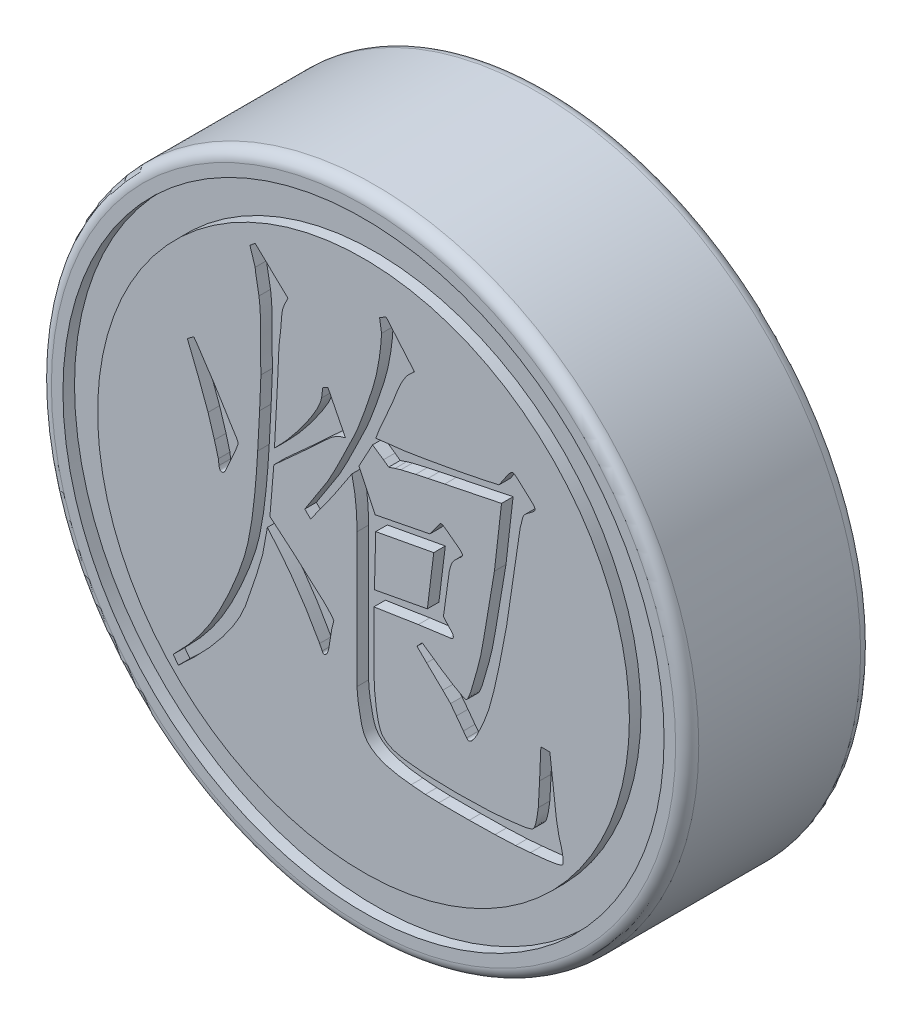
from build123d import *

# Parameters (mm, degrees)
SKETCH_1_R          = 14
EXTRUDE_1_DEPTH     = 8
SKETCH_2_R          = 13
SKETCH_2_R_2        = 11.5
CUT_EXTRUDE_1_DEPTH = 0.5
SKETCH_3_R          = 5.1
CUT_EXTRUDE_2_DEPTH = 5
CHAMFER_1_SIZE      = 0.5
FILLET_1_R          = 0.5
CUT_EXTRUDE_3_DEPTH = 0.5


with BuildPart() as part:
    # 草图1 → 凸台-拉伸1 (new body)
    with BuildSketch(Plane.XY):
        Circle(SKETCH_1_R)
    extrude(amount=EXTRUDE_1_DEPTH)

    # 草图2 → 切除-拉伸1 (cut)
    with BuildSketch(Plane.XY.offset(8)):
        Circle(SKETCH_2_R)
        Circle(SKETCH_2_R_2, mode=Mode.SUBTRACT)
    extrude(amount=-CUT_EXTRUDE_1_DEPTH, mode=Mode.SUBTRACT)

    # 草图3 → 切除-拉伸2 (cut)
    with BuildSketch(Plane(origin=(0, 0, 0), x_dir=(-1, 0, 0), z_dir=(0, 0, -1))):
        Circle(SKETCH_3_R)
    extrude(amount=-CUT_EXTRUDE_2_DEPTH, mode=Mode.SUBTRACT)

    # 倒角1
    chamfer_1_edges = [part.edges().sort_by_distance(p)[0] for p in [
        (5.1, 0, 0),
    ]]
    chamfer(chamfer_1_edges, length=CHAMFER_1_SIZE)

    # 圆角1
    fillet_1_edges = [part.edges().sort_by_distance(p)[0] for p in [
        (-14, 0, 0),
        (-14, 0, 8),
    ]]
    fillet(fillet_1_edges, radius=FILLET_1_R)

    # 草图4 → 切除-拉伸3 (cut)
    # profile 1 of 3: a face of its own
    with BuildSketch(Plane.XY.offset(8)):
        with BuildLine():
            add(Edge.make_bspline(
                [(-8.230784643, -7.445985051), (-8.038655709, -7.251958341), (-7.660131131, -6.869694842), (-7.149125234, -6.258608445), (-6.701948575, -5.62600949), (-6.317215514, -4.974370194), (-5.982119423, -4.312966272), (-5.676027104, -3.652166118), (-5.40756555, -2.989167779), (-5.207861307, -2.427128832), (-5.063947104, -1.949745176), (-4.97338362, -1.537920002), (-4.884536941, -1.076266151), (-4.803726509, -0.561800433), (-4.737674711, 0.005021424), (-4.672026968, 0.622494854), (-4.62141685, 1.292395047), (-4.592218628, 1.756200158), (-4.577045031, 1.997228245)],
                knots=[0, 0, 0, 0, 1.260269994, 2.482932462, 3.672818733, 4.833103206, 5.973250153, 7.094859764, 8.194451708, 9.274423702, 9.847723837, 10.495093642, 11.219979064, 12.018278646, 12.898683251, 13.854391619, 14.884980191, 16, 16, 16, 16], degree=3))
            Line((-4.577045031, 1.997228245), (-4.493942538, 3.548474783))
            add(Edge.make_bspline(
                [(-4.493942538, 3.548474783), (-4.489550303, 3.703607167), (-4.48154939, 3.986196903), (-4.467698162, 4.368473099), (-4.454911489, 4.668651158), (-4.443404657, 4.841194166), (-4.438540876, 4.914125752)],
                knots=[0, 0, 0, 0, 1.362474348, 2.481888401, 3.358314848, 4, 4, 4, 4], degree=3))
            add(Edge.make_bspline(
                [(-4.438540876, 4.914125752), (-4.438415042, 4.936287667), (-4.438116109, 4.988936203), (-4.441234191, 5.078531376), (-4.447582333, 5.19017632), (-4.452947112, 5.330537782), (-4.460081297, 5.51517482), (-4.456828192, 5.758086914), (-4.459725234, 6.066503803), (-4.450807023, 6.424706699), (-4.450253904, 6.803416138), (-4.461367832, 7.170133913), (-4.481280825, 7.510525558), (-4.508516805, 7.726792128), (-4.521643369, 7.831023259)],
                knots=[0, 0, 0, 0, 0.273187681, 0.648993171, 1.104874759, 1.6517242, 2.380580311, 3.382268476, 4.645761502, 6.182610836, 7.798971284, 9.313570878, 10.705257381, 12, 12, 12, 12], degree=3))
            add(Edge.make_bspline(
                [(-4.521643369, 7.831023259), (-4.527158956, 7.860575096), (-4.540084171, 7.929826796), (-4.562806877, 8.047753792), (-4.585984138, 8.196131919), (-4.619486248, 8.361635853), (-4.646087304, 8.523561087), (-4.671029075, 8.657858417), (-4.68095543, 8.753413113), (-4.68601154, 8.804246088), (-4.687848355, 8.82271301)],
                knots=[0, 0, 0, 0, 0.717301887, 1.680923484, 2.865322293, 4.299926066, 5.708925097, 6.781036436, 7.557167259, 8, 8, 8, 8], degree=3))
            Line((-4.687848355, 8.82271301), (-4.912225086, 9.531854284))
            Line((-4.912225086, 9.531854284), (-4.687848355, 9.720219935))
            Line((-4.687848355, 9.720219935), (-3.266795723, 8.373959547))
            add(Edge.make_bspline(
                [(-3.266795723, 8.373959547), (-3.291701036, 8.324101704), (-3.338563021, 8.230288888), (-3.404494136, 8.099003926), (-3.449153912, 7.98177505), (-3.493208893, 7.875116047), (-3.517108474, 7.74949873), (-3.538541639, 7.588679281), (-3.557322384, 7.379729743), (-3.56645462, 7.22440118), (-3.571504865, 7.138502484)],
                knots=[0, 0, 0, 0, 1.038040619, 1.953183423, 2.732223959, 3.3741677, 4.095887357, 5.102554719, 6.397675427, 8, 8, 8, 8], degree=3))
            Line((-3.571504865, 7.138502484), (-3.657377441, 6.373959547))
            Line((-3.657377441, 6.373959547), (-3.712779103, 5.102491403))
            Line((-3.712779103, 5.102491403), (-3.851283258, 2.46537229))
            add(Edge.make_bspline(
                [(-3.851283258, 2.46537229), (-3.73947151, 2.57891547), (-3.511535826, 2.810380793), (-3.181242855, 3.183601593), (-2.855403912, 3.586941797), (-2.594157021, 3.942221516), (-2.390285431, 4.22571734), (-2.260090568, 4.431970853), (-2.137834087, 4.619190551), (-2.039412949, 4.795698877), (-1.957875999, 4.957406654), (-1.893853162, 5.104337395), (-1.844905322, 5.237241315), (-1.824687665, 5.322959654), (-1.815272178, 5.362879215)],
                knots=[0, 0, 0, 0, 1.605989803, 3.273917005, 5.021056396, 6.830352065, 7.718621987, 8.53953928, 9.288333372, 9.971748436, 10.575269741, 11.112985508, 11.586911867, 12, 12, 12, 12], degree=3))
            Line((-1.815272178, 5.362879215), (-1.759870516, 5.792242096))
            Line((-1.759870516, 5.792242096), (-1.535493784, 5.886424921))
            Line((-1.535493784, 5.886424921), (-0.78203118, 4.390580046))
            add(Edge.make_bspline(
                [(-0.78203118, 4.390580046), (-0.846405674, 4.37303214), (-0.973493549, 4.338389132), (-1.153348448, 4.253709522), (-1.325722359, 4.153949263), (-1.491596461, 4.016537023), (-1.68334338, 3.848113084), (-1.916685142, 3.626686794), (-2.212834539, 3.357112243), (-2.544876636, 3.038811148), (-2.899454232, 2.710159426), (-3.243516014, 2.39203008), (-3.56831029, 2.100970439), (-3.778192341, 1.916730704), (-3.878984089, 1.828253176)],
                knots=[0, 0, 0, 0, 0.592189362, 1.169097933, 1.761913077, 2.358186552, 3.079599741, 4.032384349, 5.217673433, 6.640669517, 8.122064729, 9.516660475, 10.807424786, 12, 12, 12, 12], degree=3))
            Line((-3.878984089, 1.828253176), (-4.047959158, -0.191137406))
            Line((-4.047959158, -0.191137406), (-2.98701733, -1.088644331))
            Line((-2.98701733, -1.088644331), (-2.316657219, -1.686982281))
            Line((-2.316657219, -1.686982281), (-1.704468853, -2.227148486))
            add(Edge.make_bspline(
                [(-1.704468853, -2.227148486), (-1.646501624, -2.285649205), (-1.543855212, -2.389240304), (-1.419024529, -2.531383557), (-1.328444369, -2.629909783), (-1.297469638, -2.69204777), (-1.286186305, -2.714683112)],
                knots=[0, 0, 0, 0, 1.531596482, 2.712099351, 3.530849433, 4, 4, 4, 4], degree=3))
            Line((-1.286186305, -2.714683112), (-1.369288798, -3.049863167))
            Line((-1.369288798, -3.049863167), (-1.507792953, -3.89196843))
            Line((-1.507792953, -3.89196843), (-1.563194615, -4.0609435))
            add(Edge.make_bspline(
                [(-1.563194615, -4.0609435), (-1.580824752, -4.091284527), (-1.611113902, -4.143411403), (-1.683244723, -4.192684184), (-1.762297399, -4.170273502), (-1.778421521, -4.123497934), (-1.787571347, -4.09695458)],
                knots=[0, 0, 0, 0, 1.313047959, 2.255859308, 3.01026656, 4, 4, 4, 4], degree=3))
            Line((-1.787571347, -4.09695458), (-1.898374671, -3.872577849))
            add(Edge.make_bspline(
                [(-1.898374671, -3.872577849), (-2.063626793, -3.578535659), (-2.390540241, -2.996840581), (-2.941859455, -2.171014642), (-3.522772827, -1.385675807), (-3.94768991, -0.898506834), (-4.158762482, -0.656511367)],
                knots=[0, 0, 0, 0, 1.027019789, 2.031723261, 3.022281639, 4, 4, 4, 4], degree=3))
            add(Edge.make_bspline(
                [(-4.158762482, -0.656511367), (-4.175729776, -0.765566481), (-4.207845167, -0.971984047), (-4.261835287, -1.261378348), (-4.308079028, -1.514722894), (-4.347822795, -1.710508623), (-4.385557189, -1.876141006), (-4.430988687, -2.036614833), (-4.492924069, -2.238249538), (-4.566057107, -2.483145894), (-4.662849735, -2.765812215), (-4.765919012, -3.093391252), (-4.893481471, -3.459313845), (-5.025658745, -3.869509935), (-5.197590425, -4.307844998), (-5.430857621, -4.760420153), (-5.719835903, -5.22631438), (-6.071038434, -5.7027308), (-6.471064253, -6.19818009), (-6.931042056, -6.70541725), (-7.446403967, -7.226122395), (-7.817553573, -7.56842388), (-8.009177995, -7.745154026)],
                knots=[0, 0, 0, 0, 0.800570352, 1.51530522, 2.135388172, 2.668727991, 2.964437506, 3.367445504, 3.878138077, 4.494701821, 5.221234822, 6.045224737, 6.985698656, 8.03207976, 9.171427023, 10.396633739, 11.720104297, 13.144307082, 14.687312874, 16.337768313, 18.109190966, 20, 20, 20, 20], degree=3))
            Line((-8.009177995, -7.745154026), (-8.230784643, -7.445985051))
        make_face()
    # profile 2 of 3: a face of its own
    with BuildSketch(Plane.XY.offset(8)):
        with BuildLine():
            Line((-7.338817884, 4.894735171), (-7.142141984, 4.614956777))
            Line((-7.142141984, 4.614956777), (-6.474551956, 3.606646528))
            Line((-6.474551956, 3.606646528), (-5.914995169, 2.709139603))
            Line((-5.914995169, 2.709139603), (-5.721089352, 2.390580046))
            add(Edge.make_bspline(
                [(-5.721089352, 2.390580046), (-5.676361372, 2.323470243), (-5.598093512, 2.206037248), (-5.501972205, 2.051087347), (-5.444465409, 1.941535222), (-5.417555605, 1.839181768), (-5.468402148, 1.719610628), (-5.503113676, 1.625570505), (-5.524413452, 1.567865365)],
                knots=[0, 0, 0, 0, 1.581087075, 2.766686593, 3.568082193, 4.011737207, 4.779957102, 6, 6, 6, 6], degree=3))
            Line((-5.524413452, 1.567865365), (-5.914995169, 0.689749021))
            Line((-5.914995169, 0.689749021), (-5.973166914, 0.556785032))
            add(Edge.make_bspline(
                [(-5.973166914, 0.556785032), (-5.992437556, 0.525584606), (-6.028231562, 0.467631777), (-6.1086265, 0.429349087), (-6.173346222, 0.439108176), (-6.211467926, 0.47804834), (-6.235220978, 0.539212653), (-6.244660987, 0.587026843), (-6.250175225, 0.614956777)],
                knots=[0, 0, 0, 0, 1.474519744, 2.738827728, 3.351088726, 4.01649337, 4.841364677, 6, 6, 6, 6], degree=3))
            Line((-6.250175225, 0.614956777), (-6.277876056, 0.855954007))
            add(Edge.make_bspline(
                [(-6.277876056, 0.855954007), (-6.285256783, 0.88734846), (-6.303297656, 0.964086608), (-6.335378922, 1.099710732), (-6.386990392, 1.273552912), (-6.425588675, 1.402596772), (-6.446851125, 1.473682539)],
                knots=[0, 0, 0, 0, 0.604144683, 1.476724042, 2.610015163, 4, 4, 4, 4], degree=3))
            Line((-6.446851125, 1.473682539), (-6.723859435, 2.371189464))
            add(Edge.make_bspline(
                [(-6.723859435, 2.371189464), (-6.780770232, 2.529207528), (-6.903523698, 2.870043818), (-7.108455424, 3.415254545), (-7.349798927, 4.030139605), (-7.525740641, 4.461887952), (-7.618596277, 4.689749021)],
                knots=[0, 0, 0, 0, 0.810893304, 1.749052348, 2.812031724, 4, 4, 4, 4], degree=3))
            Line((-7.618596277, 4.689749021), (-7.338817884, 4.894735171))
        make_face()
    # profile 3 of 3: a face of its own
    with BuildSketch(Plane.XY.offset(8)):
        with BuildLine():
            Line((0.694423113, 9.62603711), (0.974201507, 9.795012179))
            Line((0.974201507, 9.795012179), (2.201348321, 8.354568966))
            add(Edge.make_bspline(
                [(2.201348321, 8.354568966), (2.142369549, 8.302836895), (2.034771692, 8.208459549), (1.888345649, 8.056415932), (1.760095979, 7.876205659), (1.653504933, 7.690998061), (1.558629561, 7.490675272), (1.466786037, 7.283740544), (1.36691778, 7.022387929), (1.293718266, 6.831927083), (1.2539799, 6.728530185)],
                knots=[0, 0, 0, 0, 0.986487641, 1.799697651, 2.64740669, 3.760705744, 4.482574025, 5.433997534, 6.606975122, 8, 8, 8, 8], degree=3))
            Line((1.2539799, 6.728530185), (0.694423113, 5.45706204))
            Line((0.694423113, 5.45706204), (0.528218127, 5.02769916))
            Line((0.528218127, 5.02769916), (0.974201507, 5.083100822))
            Line((0.974201507, 5.083100822), (1.783065773, 5.177283647))
            Line((1.783065773, 5.177283647), (2.591930039, 5.307477553))
            Line((2.591930039, 5.307477553), (3.53929846, 5.476452622))
            Line((3.53929846, 5.476452622), (4.434035302, 5.642657608))
            Line((4.434035302, 5.642657608), (5.159797075, 5.792242096))
            Line((5.159797075, 5.792242096), (5.855087933, 5.941826583))
            Line((5.855087933, 5.941826583), (6.273370482, 6.559555115))
            add(Edge.make_bspline(
                [(6.273370482, 6.559555115), (6.304512741, 6.593476038), (6.353181864, 6.646487655), (6.440461111, 6.711940008), (6.543450824, 6.672868132), (6.600078614, 6.627388074), (6.636251368, 6.598336279)],
                knots=[0, 0, 0, 0, 1.277056571, 1.995783994, 2.719744939, 4, 4, 4, 4], degree=3))
            Line((6.636251368, 6.598336279), (7.33431231, 5.961217165))
            add(Edge.make_bspline(
                [(7.33431231, 5.961217165), (7.35749419, 5.933468448), (7.398225295, 5.884713303), (7.426554388, 5.803154676), (7.399703376, 5.739627207), (7.349255984, 5.685539684), (7.269128706, 5.62214108), (7.204392954, 5.576709909), (7.168107324, 5.551244866)],
                knots=[0, 0, 0, 0, 1.201333071, 2.110770257, 2.631687976, 3.388904856, 4.536431109, 6, 6, 6, 6], degree=3))
            add(Edge.make_bspline(
                [(7.168107324, 5.551244866), (7.112274786, 5.511572192), (7.015561111, 5.442850791), (6.909644813, 5.312291279), (6.863464075, 5.164627135), (6.843778587, 5.063856709), (6.832927268, 5.008308578)],
                knots=[0, 0, 0, 0, 1.235830438, 2.140717761, 2.975099566, 4, 4, 4, 4], degree=3))
            Line((6.832927268, 5.008308578), (6.777525606, 4.803322428))
            Line((6.777525606, 4.803322428), (6.190267989, 0.839333509))
            add(Edge.make_bspline(
                [(6.190267989, 0.839333509), (6.174920523, 0.746935084), (6.141411549, 0.545196467), (6.078825411, 0.218778286), (6.008255117, -0.15749561), (5.894560054, -0.709479054), (5.754006708, -1.394786982), (5.598289871, -2.059735217), (5.462164624, -2.564951383), (5.331953626, -2.93917764), (5.183252584, -3.322961488), (5.039578102, -3.639238891), (4.919430201, -3.877116962), (4.83763214, -4.025646394), (4.759631937, -4.14051364), (4.690398455, -4.225110009), (4.624552534, -4.277450556), (4.561454442, -4.299278173), (4.497913939, -4.283594299), (4.474584312, -4.248980958), (4.461736133, -4.229918569)],
                knots=[0, 0, 0, 0, 0.904521174, 1.97489136, 3.209603914, 4.60167021, 7.417411833, 9.965319302, 11.196355477, 12.468153963, 13.78959662, 15.170392796, 15.820437057, 16.363513007, 16.806244704, 17.160250409, 17.415290706, 17.610046929, 17.785243582, 18, 18, 18, 18], degree=3))
            Line((4.461736133, -4.229918569), (4.320461894, -4.041552918))
            Line((4.320461894, -4.041552918), (4.015752753, -3.631580619))
            Line((4.015752753, -3.631580619), (3.763675191, -3.29363048))
            Line((3.763675191, -3.29363048), (3.428495135, -2.958450425))
            Line((3.428495135, -2.958450425), (2.730434194, -2.285320231))
            Line((2.730434194, -2.285320231), (2.312151645, -1.872577849))
            Line((2.312151645, -1.872577849), (2.536528376, -1.628810536))
            Line((2.536528376, -1.628810536), (3.373093473, -2.210527987))
            add(Edge.make_bspline(
                [(3.373093473, -2.210527987), (3.446098949, -2.258444466), (3.582691989, -2.348096064), (3.773472698, -2.475341583), (3.944199327, -2.576961334), (4.088012316, -2.662989353), (4.209749554, -2.727605473), (4.304544199, -2.775098784), (4.376955045, -2.804402532), (4.41821204, -2.807628633), (4.434035302, -2.808865937)],
                knots=[0, 0, 0, 0, 1.711797798, 3.202768874, 4.494051126, 5.605355352, 6.487964076, 7.192211438, 7.690189523, 8, 8, 8, 8], degree=3))
            add(Edge.make_bspline(
                [(4.434035302, -2.808865937), (4.444789366, -2.804050508), (4.472708786, -2.791548816), (4.502280833, -2.7408696), (4.538198711, -2.671965878), (4.579447571, -2.576056819), (4.626764163, -2.455874408), (4.671862925, -2.307606408), (4.724947384, -2.136044906), (4.799799523, -1.883547343), (4.882529398, -1.577283643), (4.972632326, -1.24825874), (5.03983759, -0.979650015), (5.082020951, -0.785361622), (5.108871646, -0.635247245), (5.134326659, -0.49868681), (5.164188286, -0.330524416), (5.201179894, -0.130489058), (5.239489339, 0.101375634), (5.279702075, 0.365970833), (5.331273234, 0.660866151), (5.381517938, 0.977817885), (5.430817112, 1.293085783), (5.483423506, 1.584102685), (5.521997875, 1.841605672), (5.563335591, 2.062467735), (5.591820702, 2.249644133), (5.620554925, 2.40166061), (5.641893924, 2.520008719), (5.655558108, 2.587272033), (5.661182116, 2.614956777)],
                knots=[0, 0, 0, 0, 0.173830161, 0.451293304, 0.842211205, 1.357762813, 2.012158328, 2.784333819, 3.683952171, 4.711128073, 6.740690836, 8.450244368, 9.836519207, 10.900419421, 11.43646931, 12.127625488, 12.987537443, 14.002555873, 15.183975562, 16.518253093, 18.023538594, 19.681656574, 21.339774554, 22.81770537, 24.124583284, 25.251302315, 26.1932478, 26.968780862, 27.575563005, 28, 28, 28, 28], degree=3))
            Line((5.661182116, 2.614956777), (5.96866134, 5.307477553))
            Line((5.96866134, 5.307477553), (3.511597629, 4.803322428))
            Line((3.511597629, 4.803322428), (2.788605939, 4.653737941))
            Line((2.788605939, 4.653737941), (2.256749983, 4.540164534))
            Line((2.256749983, 4.540164534), (1.616860786, 4.390580046))
            Line((1.616860786, 4.390580046), (1.364783224, 4.315787802))
            Line((1.364783224, 4.315787802), (1.085004831, 4.221604977))
            Line((1.085004831, 4.221604977), (0.863398183, 4.390580046))
            Line((0.863398183, 4.390580046), (0.389713972, 4.709139603))
            Line((0.389713972, 4.709139603), (-0.197543646, 3.623267027))
            Line((-0.197543646, 3.623267027), (0.500517296, 2.146812733))
            Line((0.500517296, 2.146812733), (2.871708432, 2.614956777))
            Line((2.871708432, 2.614956777), (3.28999098, 3.193904146))
            add(Edge.make_bspline(
                [(3.28999098, 3.193904146), (3.300906467, 3.2068284), (3.322472677, 3.23236342), (3.380113916, 3.238985069), (3.444879804, 3.219271423), (3.487401417, 3.190745668), (3.511597629, 3.174513564)],
                knots=[0, 0, 0, 0, 0.785352032, 1.551654695, 2.606810097, 4, 4, 4, 4], degree=3))
            Line((3.511597629, 3.174513564), (4.154256908, 2.689749021))
            add(Edge.make_bspline(
                [(4.154256908, 2.689749021), (4.183543823, 2.66302689), (4.233148122, 2.617766657), (4.293315513, 2.533301059), (4.249216991, 2.433842173), (4.191075442, 2.395481575), (4.154256908, 2.371189464)],
                knots=[0, 0, 0, 0, 1.174753668, 1.989722471, 2.726978034, 4, 4, 4, 4], degree=3))
            add(Edge.make_bspline(
                [(4.154256908, 2.371189464), (4.116006613, 2.336515162), (4.04533595, 2.272451448), (3.953483912, 2.178330872), (3.88291886, 2.095753514), (3.814224043, 1.992486653), (3.756193613, 1.834689631), (3.725737361, 1.700317159), (3.708273529, 1.623267027)],
                knots=[0, 0, 0, 0, 1.039358594, 1.920303144, 2.646367843, 3.223937085, 4.408185752, 6, 6, 6, 6], degree=3))
            Line((3.708273529, 1.623267027), (3.456195966, -0.191137406))
            Line((3.456195966, -0.191137406), (3.846777684, -0.620500286))
            add(Edge.make_bspline(
                [(3.846777684, -0.620500286), (3.861956324, -0.648017598), (3.889401498, -0.697772872), (3.884244681, -0.782359028), (3.822779616, -0.841527735), (3.767925847, -0.843644206), (3.73597436, -0.844877018)],
                knots=[0, 0, 0, 0, 1.136000595, 2.054053096, 2.866515467, 4, 4, 4, 4], degree=3))
            Line((3.73597436, -0.844877018), (2.37032339, -1.030472586))
            Line((2.37032339, -1.030472586), (0.445115634, -1.329641561))
            Line((0.445115634, -1.329641561), (0.445115634, -3.238228818))
            add(Edge.make_bspline(
                [(0.445115634, -3.238228818), (0.448019063, -3.450577956), (0.453854015, -3.877330952), (0.476883747, -4.515652569), (0.55607459, -5.141364687), (0.646732593, -5.601160994), (0.764019467, -5.885080407), (0.859500225, -6.009884309), (0.985994273, -6.117123827), (1.142036955, -6.210358472), (1.32995145, -6.282913807), (1.547138695, -6.343062462), (1.794414415, -6.390629607), (1.970303177, -6.406935211), (2.062844166, -6.415514137)],
                knots=[0, 0, 0, 0, 1.852530892, 3.722987139, 5.564932606, 7.354135247, 7.78669376, 8.229623299, 8.709181498, 9.225721665, 9.807455056, 10.460117356, 11.18981599, 12, 12, 12, 12], degree=3))
            Line((2.062844166, -6.415514137), (2.647331701, -6.473685882))
            Line((2.647331701, -6.473685882), (3.262290149, -6.490306381))
            Line((3.262290149, -6.490306381), (4.043453584, -6.509696962))
            Line((4.043453584, -6.509696962), (5.519907878, -6.473685882))
            Line((5.519907878, -6.473685882), (6.331542227, -6.398893638))
            add(Edge.make_bspline(
                [(6.331542227, -6.398893638), (6.399916309, -6.392870181), (6.529446028, -6.38145918), (6.711234029, -6.358709079), (6.871175076, -6.336973108), (7.008383806, -6.313569265), (7.12240486, -6.284650777), (7.214675034, -6.259716586), (7.282436465, -6.227992674), (7.35676604, -6.184768726), (7.414705866, -6.066708481), (7.468223239, -5.879805633), (7.518788761, -5.612372958), (7.54434621, -5.408207863), (7.558689041, -5.29363048)],
                knots=[0, 0, 0, 0, 1.255069487, 2.377637762, 3.349517097, 4.20733604, 4.919915975, 5.502143265, 5.947920636, 6.289816273, 7.048703625, 8.23426786, 9.886672378, 12, 12, 12, 12], degree=3))
            Line((7.558689041, -5.29363048), (7.614090703, -4.265929649))
            Line((7.614090703, -4.265929649), (7.669492365, -2.958450425))
            Line((7.669492365, -2.958450425), (8.060074083, -2.958450425))
            Line((8.060074083, -2.958450425), (8.339852476, -5.313021062))
            Line((8.339852476, -5.313021062), (8.4506558, -5.911359012))
            Line((8.4506558, -5.911359012), (8.561459124, -6.285320231))
            add(Edge.make_bspline(
                [(8.561459124, -6.285320231), (8.576783209, -6.358912334), (8.604246774, -6.490802858), (8.633532873, -6.668623206), (8.634221459, -6.798914885), (8.631869905, -6.894596856), (8.57616905, -6.946858045), (8.496801878, -6.970571647), (8.382724374, -7.002294139), (8.227610328, -7.030576852), (8.033729384, -7.060986284), (7.799948886, -7.090907667), (7.525822123, -7.121970335), (7.328829057, -7.138160299), (7.223508986, -7.146816076)],
                knots=[0, 0, 0, 0, 1.321112663, 2.367675807, 3.128929365, 3.65614239, 3.930950435, 4.40305985, 5.090461535, 6.014610705, 7.162046277, 8.533890099, 10.146884315, 12, 12, 12, 12], degree=3))
            Line((7.223508986, -7.146816076), (6.580849706, -7.202217738))
            Line((6.580849706, -7.202217738), (5.688882947, -7.238228818))
            Line((5.688882947, -7.238228818), (4.572539457, -7.2576194))
            Line((4.572539457, -7.2576194), (3.262290149, -7.2576194))
            Line((3.262290149, -7.2576194), (2.675032532, -7.238228818))
            Line((2.675032532, -7.238228818), (2.062844166, -7.182827156))
            add(Edge.make_bspline(
                [(2.062844166, -7.182827156), (1.912928157, -7.168676895), (1.629164404, -7.141893024), (1.231947299, -7.066284838), (0.884914103, -6.972786786), (0.58986684, -6.849047634), (0.344197768, -6.694937252), (0.146670073, -6.507150269), (0.005111145, -6.279499537), (-0.077177939, -6.026910166), (-0.130573552, -5.776465841), (-0.172898647, -5.542840423), (-0.215201524, -5.337018648), (-0.237477374, -5.155159676), (-0.259293556, -5.000374207), (-0.268331835, -4.869786932), (-0.278410034, -4.765605912), (-0.27998073, -4.704541374), (-0.280646139, -4.678672032)],
                knots=[0, 0, 0, 0, 1.819699616, 3.444360574, 4.882786151, 6.158124821, 7.29778394, 8.371504177, 9.424714908, 10.501622555, 11.566016055, 12.520653276, 13.372416867, 14.105000623, 14.735050586, 15.261655952, 15.687208386, 16, 16, 16, 16], degree=3))
            Line((-0.280646139, -4.678672032), (-0.280646139, -3.2576194))
            Line((-0.280646139, -3.2576194), (-0.280646139, 1.119111902))
            add(Edge.make_bspline(
                [(-0.280646139, 1.119111902), (-0.280832256, 1.263203056), (-0.281174943, 1.528509288), (-0.304793693, 1.891497405), (-0.333235149, 2.18679111), (-0.357003632, 2.40129248), (-0.385147359, 2.571862975), (-0.416587556, 2.734029013), (-0.454067035, 2.94056778), (-0.486945484, 3.091517607), (-0.50502287, 3.174513564)],
                knots=[0, 0, 0, 0, 1.668125029, 3.071416634, 4.209825398, 5.103698424, 5.569516584, 6.211228592, 7.016489141, 8, 8, 8, 8], degree=3))
            add(Edge.make_bspline(
                [(-0.50502287, 3.174513564), (-0.628004937, 2.982887612), (-0.886409654, 2.580251265), (-1.3074575, 1.958612839), (-1.779220027, 1.290535312), (-2.11461984, 0.833254785), (-2.288956388, 0.595566196)],
                knots=[0, 0, 0, 0, 0.871120789, 1.830362164, 2.872249909, 4, 4, 4, 4], degree=3))
            Line((-2.288956388, 0.595566196), (-2.54103395, 0.839333509))
            add(Edge.make_bspline(
                [(-2.54103395, 0.839333509), (-2.479268005, 0.935427186), (-2.362245641, 1.117487209), (-2.194538546, 1.375059056), (-2.050482949, 1.605516868), (-1.917703969, 1.801158181), (-1.810541707, 1.970375807), (-1.722699689, 2.110005801), (-1.649851361, 2.216296564), (-1.594483616, 2.303709541), (-1.541513063, 2.385515068), (-1.488162847, 2.483311757), (-1.41958534, 2.598397334), (-1.34932099, 2.738885334), (-1.265751056, 2.899280514), (-1.171495919, 3.080228536), (-1.072366559, 3.284593395), (-0.964268151, 3.502015784), (-0.856723456, 3.721571989), (-0.758652984, 3.929653364), (-0.664902494, 4.115515262), (-0.585907872, 4.284657964), (-0.513895228, 4.434251768), (-0.449802232, 4.563811313), (-0.397008601, 4.674555313), (-0.336840169, 4.807471666), (-0.25769158, 4.988717635), (-0.151660097, 5.246349051), (-0.034980323, 5.569369159), (0.098004528, 5.935278515), (0.227488506, 6.312296991), (0.344445617, 6.66271627), (0.439229876, 6.970126494), (0.537884729, 7.327950881), (0.632092995, 7.764327499), (0.69940464, 8.202017366), (0.736116614, 8.543003873), (0.764792478, 8.760324706), (0.77451137, 8.936216826), (0.778550272, 9.03877859), (0.780295689, 9.083100822)],
                knots=[0, 0, 0, 0, 1.448510299, 2.744361804, 3.89740615, 4.894357403, 5.742079353, 6.437140272, 6.98594766, 7.375687498, 7.749263362, 8.221252064, 8.787638506, 9.447488424, 10.212051849, 11.081331523, 12.034342409, 13.092076762, 14.160321977, 15.134390131, 16.008858642, 16.799687595, 17.501422508, 18.114085492, 18.632579471, 19.057006079, 19.964101378, 21.140393144, 22.588903442, 24.318489776, 26.077314611, 27.64351202, 29.002768883, 30.155991557, 32.349253062, 34.65929163, 35.767410136, 36.69837259, 37.437499617, 38, 38, 38, 38], degree=3))
            Line((0.780295689, 9.083100822), (0.694423113, 9.62603711))
        make_face()
        Polygon((0.528218127, 1.529084201), (0.472816465, -0.675901948), (2.760905108, -0.246539068), (3.037913418, 1.997228245), align=None, mode=Mode.SUBTRACT)
    extrude(amount=-CUT_EXTRUDE_3_DEPTH, mode=Mode.SUBTRACT)


solid = part.part
